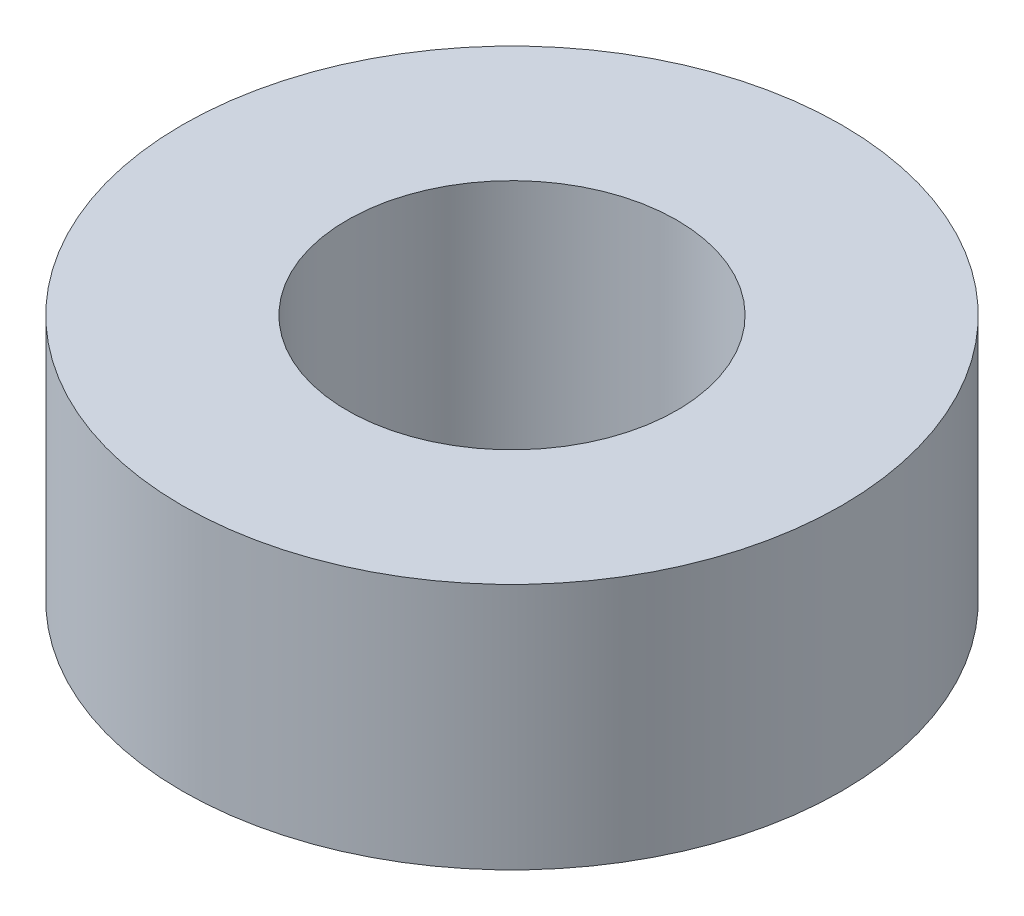
from build123d import *

# Parameters (mm, degrees)
SKETCH1_W = 2
SKETCH1_H = 3


with BuildPart() as part:
    # Sketch1 → Revolve1 (revolve)
    with BuildSketch(Plane.XY, mode=Mode.PRIVATE) as revolve1_sk:
        with Locations((3, -1)):
            Rectangle(SKETCH1_W, SKETCH1_H)
    revolve(revolve1_sk.sketch.rotate(Axis((0, 0.8, 0), (0, -1, 0)), 270), axis=Axis((0, 0.8, 0), (0, -1, 0)))


solid = part.part
